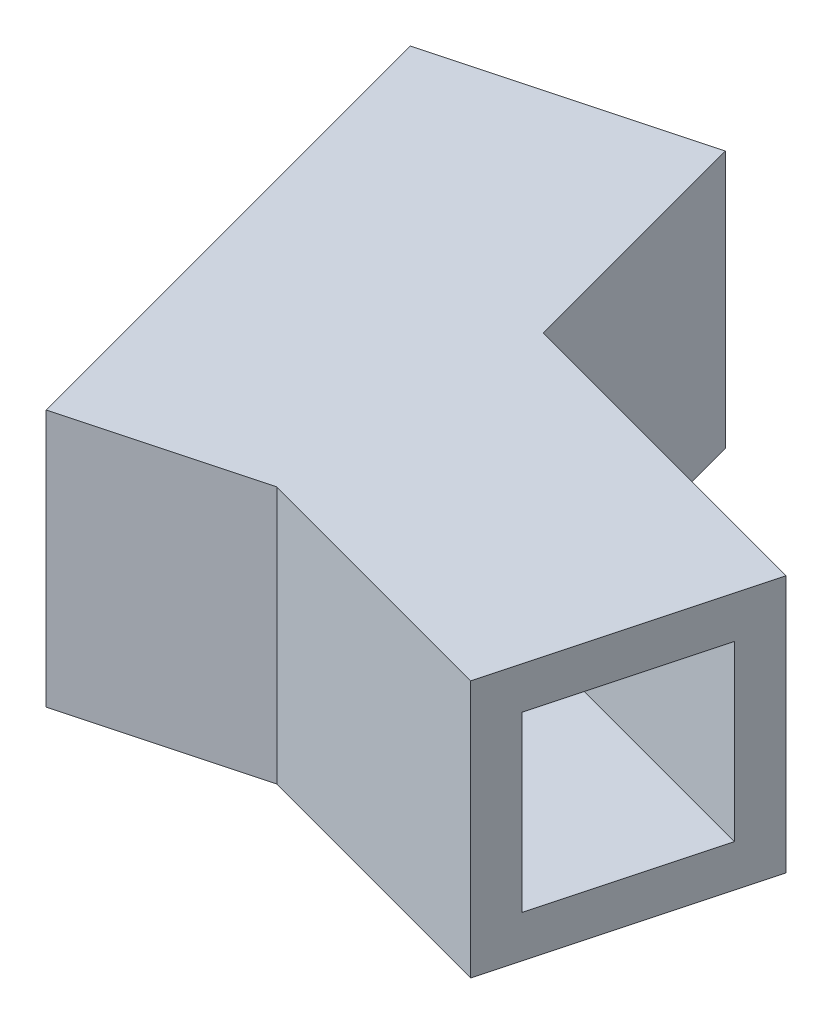
from build123d import *

# Parameters (mm, degrees)
BOSS_EXTRUDE1_DEPTH = 15
SKETCH2_W           = 10.1
SKETCH2_H           = 10.1
CUT_EXTRUDE1_DEPTH  = 18
SKETCH3_W           = 10.1
SKETCH3_H           = 10.1
CUT_EXTRUDE2_DEPTH  = 17
CUT_EXTRUDE3_REACH  = 41.336
SKETCH4_W           = 8
SKETCH4_H           = 8
CUT_EXTRUDE4_REACH  = 34.317
SKETCH5_W           = 8
SKETCH5_H           = 8
FILLET1_R           = 6
FILLET2_R           = 3


with BuildPart() as part:
    # Sketch1 → Boss-Extrude1 (new body)
    with BuildSketch(Plane(origin=(0, 0, 0), x_dir=(1, 0, 0), z_dir=(0, 1, 0))):
        Polygon((0, 0), (15.436230849, -4.13612559), (19.318516526, 10.352761804), (0, 15.529142706), (-3.882285677, 30.0180301), (-18.371173071, 26.135744424), (-10.606601718, -2.842030365), align=None)
    extrude(amount=BOSS_EXTRUDE1_DEPTH)

    # Sketch2 → Cut-Extrude1 (cut)
    with BuildSketch(Plane(origin=(15.436230849, 0, 4.13612559), x_dir=(0.2588190451025214, 0, -0.9659258262890681), z_dir=(0.9659258262890681, 0, 0.2588190451025214))):
        with Locations((7.5, 7.5)):
            Rectangle(SKETCH2_W, SKETCH2_H)
    extrude(amount=-CUT_EXTRUDE1_DEPTH, mode=Mode.SUBTRACT)

    # Sketch3 → Cut-Extrude2 (cut)
    with BuildSketch(Plane(origin=(-7.764571353, 0, -28.977774789), x_dir=(-0.9659258262890682, 0, 0.2588190451025212), z_dir=(-0.2588190451025212, 0, -0.9659258262890682))):
        with Locations((3.480762114, 7.5)):
            Rectangle(SKETCH3_W, SKETCH3_H)
    extrude(amount=-CUT_EXTRUDE2_DEPTH, mode=Mode.SUBTRACT)

    # Cut-Extrude3: up to this plane
    cut_extrude3_end = Plane(origin=(-11.60473103, 12.55, -10.349112038), z_dir=(-0.9659258262890682, 0, 0.2588190451025212))
    # Sketch4 → Cut-Extrude3 (cut, up to the surface)
    with BuildSketch(Plane(origin=(-1.950434024, 0, -0.522617222), x_dir=(0.25881904510252146, 0, -0.9659258262890681), z_dir=(0.9659258262890681, 0, 0.25881904510252146)), mode=Mode.PRIVATE) as cut_extrude3_sk1:
        with Locations((7.5, 7.5)):
            Rectangle(SKETCH4_W, SKETCH4_H)
    cut_extrude3_tool1 = split(extrude(cut_extrude3_sk1.sketch, amount=-CUT_EXTRUDE3_REACH, mode=Mode.PRIVATE), bisect_by=cut_extrude3_end, keep=Keep.BOTH, mode=Mode.PRIVATE)
    add(cut_extrude3_tool1.solids().sort_by_distance((-0.009291, 7.5, -7.767061))[0], mode=Mode.SUBTRACT)

    # Cut-Extrude4: up to this face of the body (flat: up to its plane)
    cut_extrude4_end = Plane(part.part.faces().sort_by_distance((-5.802700436, 7.5, -5.178295527))[0])
    # Sketch5 → Cut-Extrude4 (cut, up to the picked face)
    with BuildSketch(Plane(origin=(-3.364647586, 0, -12.557035742), x_dir=(-0.9659258262890682, 0, 0.25881904510252124), z_dir=(-0.25881904510252124, 0, -0.9659258262890682)), mode=Mode.PRIVATE) as cut_extrude4_sk1:
        with Locations((3.480762114, 7.5)):
            Rectangle(SKETCH5_W, SKETCH5_H)
    cut_extrude4_tool1 = split(extrude(cut_extrude4_sk1.sketch, amount=-CUT_EXTRUDE4_REACH, mode=Mode.PRIVATE), bisect_by=cut_extrude4_end, keep=Keep.BOTH, mode=Mode.PRIVATE)
    add(cut_extrude4_tool1.solids().sort_by(Axis((-6.726806, 7.5, -11.656148), (0.25881904510252124, 0, 0.9659258262890682)))[0], mode=Mode.SUBTRACT)

    # Fillet1
    fillet1_edges = [part.edges().sort_by_distance(p)[0] for p in [
        (-10.560833506, 7.5, -6.453233441),
    ]]
    fillet(fillet1_edges, radius=FILLET1_R)

    # Fillet2
    fillet2_edges = [part.edges().sort_by_distance(p)[0] for p in [
        (-11.531070004, 11.5, -10.074205347),
        (-0.915876519, 11.5, -12.151084448),
        (-0.915876519, 3.5, -12.151084448),
        (-11.531070004, 3.5, -10.074205347),
        (-4.129667829, 3.5, -4.730007791),
        (-9.904494707, 3.5, -7.109572239),
        (-4.129667829, 11.5, -4.730007791),
        (-9.904494707, 11.5, -7.109572239),
    ]]
    fillet(fillet2_edges, radius=FILLET2_R)


solid = part.part
